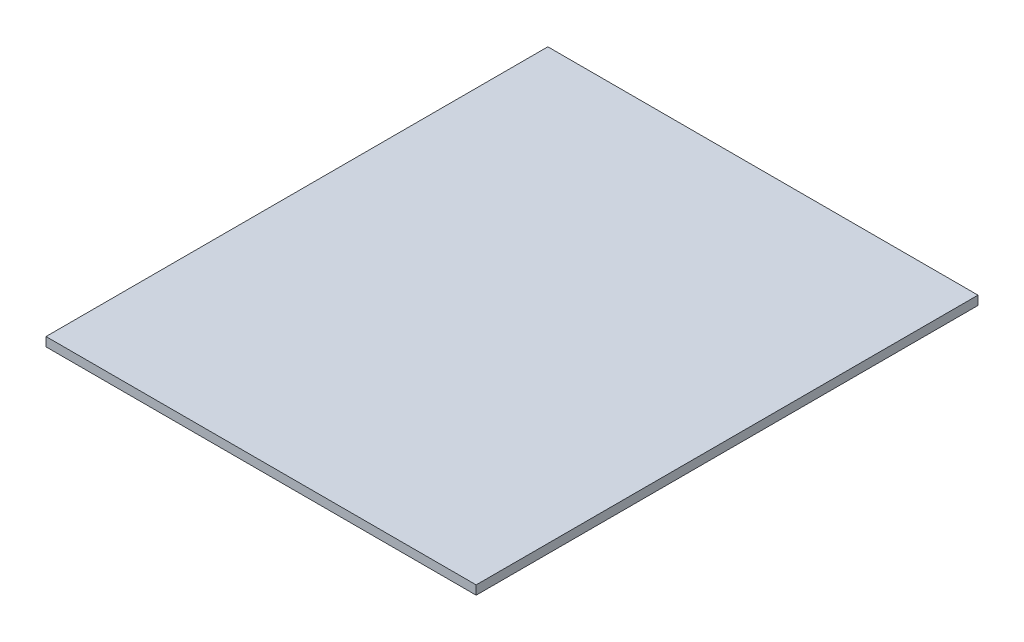
from build123d import *

# Parameters (mm, degrees)
SKETCH1_W           = 152.4
SKETCH1_H           = 177.8
BOSS_EXTRUDE1_DEPTH = 3.175


with BuildPart() as part:
    # Sketch1 → Boss-Extrude1 (new body)
    with BuildSketch(Plane(origin=(0, 0, 0), x_dir=(1, 0, 0), z_dir=(0, 1, 0))):
        with Locations((76.2, 88.9)):
            Rectangle(SKETCH1_W, SKETCH1_H)
    extrude(amount=BOSS_EXTRUDE1_DEPTH)


solid = part.part
